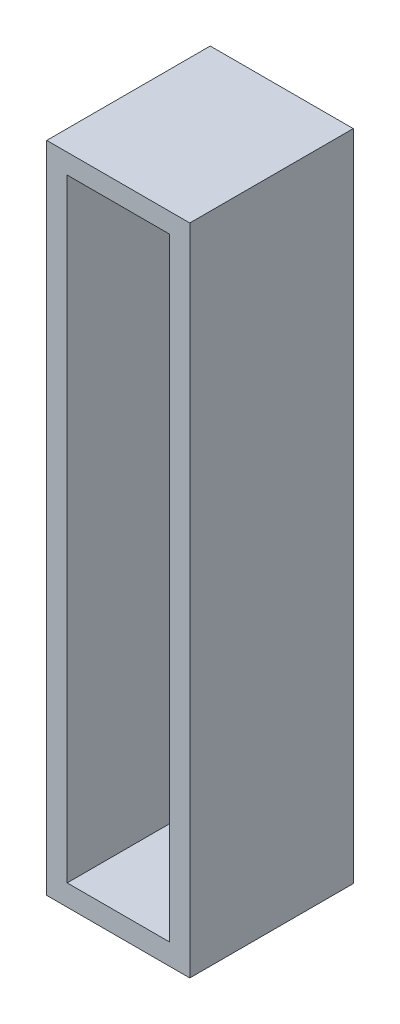
from build123d import *

# Parameters (mm, degrees)
SKETCH4_W           = 8.89
SKETCH4_H           = 40.64
SKETCH4_W_2         = 6.35
SKETCH4_H_2         = 38.1
BOSS_EXTRUDE2_DEPTH = 10.16


with BuildPart() as part:
    # Sketch4 → Boss-Extrude2 (new body)
    with BuildSketch(Plane.XY):
        with Locations((1.44859375, 1.3890625)):
            Rectangle(SKETCH4_W, SKETCH4_H)
        with Locations((1.44859375, 1.42875)):
            Rectangle(SKETCH4_W_2, SKETCH4_H_2, mode=Mode.SUBTRACT)
    extrude(amount=BOSS_EXTRUDE2_DEPTH)


solid = part.part
